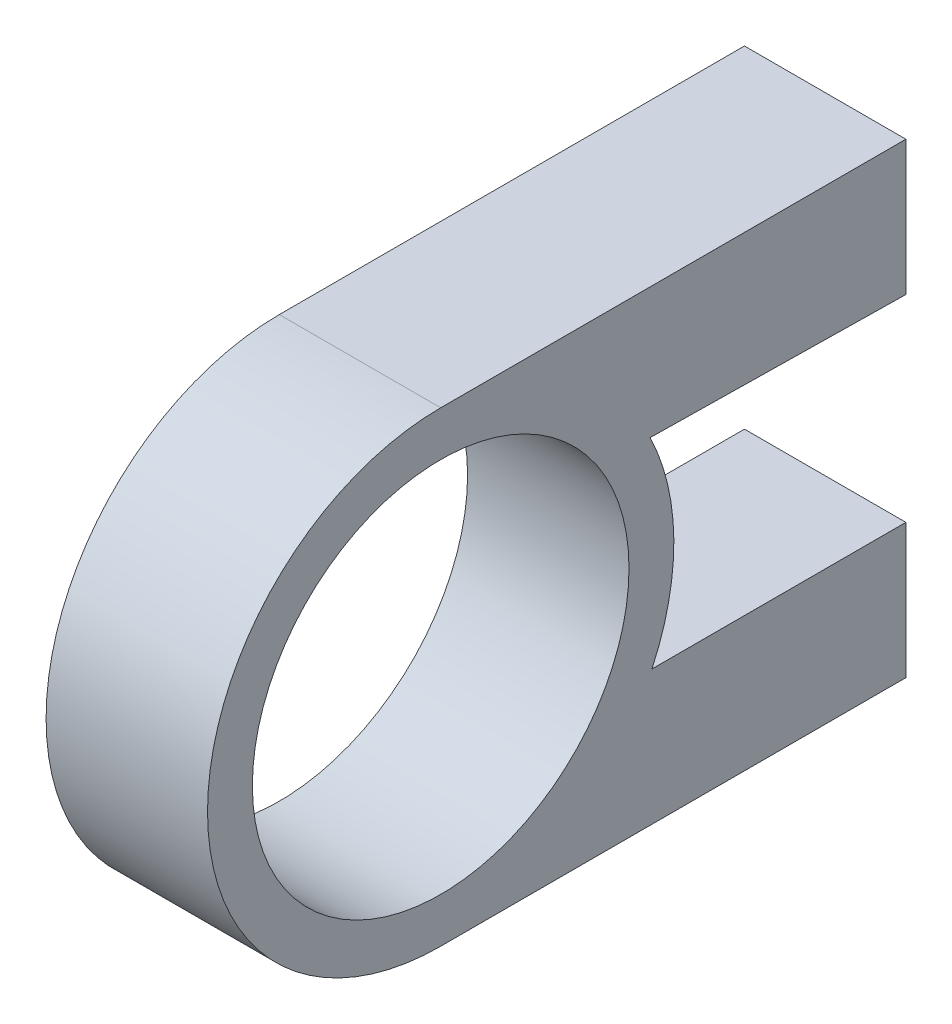
from build123d import *

# Parameters (mm, degrees)
SKETCH1_R           = 2.1
BOSS_EXTRUDE2_DEPTH = 1.8


with BuildPart() as part:
    # Sketch1 → Boss-Extrude2 (new body)
    with BuildSketch(Plane.YZ):
        with BuildLine():
            Line((-2.6, 0), (-2.6, -5.1875))
            Line((-2.6, -5.1875), (-1.1, -5.1875))
            Line((-1.1, -5.1875), (-1.1, -2.355843798))
            ThreePointArc((-1.1, -2.355843798), (0.024387933, -2.599885618), (1.144, -2.334794209))
            Line((1.144, -2.334794209), (1.1, -5.1875))
            Line((1.1, -5.1875), (2.6, -5.1875))
            Line((2.6, -5.1875), (2.6, 0))
            ThreePointArc((2.6, 0), (0, 2.6), (-2.6, 0))
        make_face()
        with Locations(Location((0, 0, 0), (0, 0, 270))):
            Circle(SKETCH1_R, mode=Mode.SUBTRACT)
    extrude(amount=BOSS_EXTRUDE2_DEPTH)


solid = part.part
